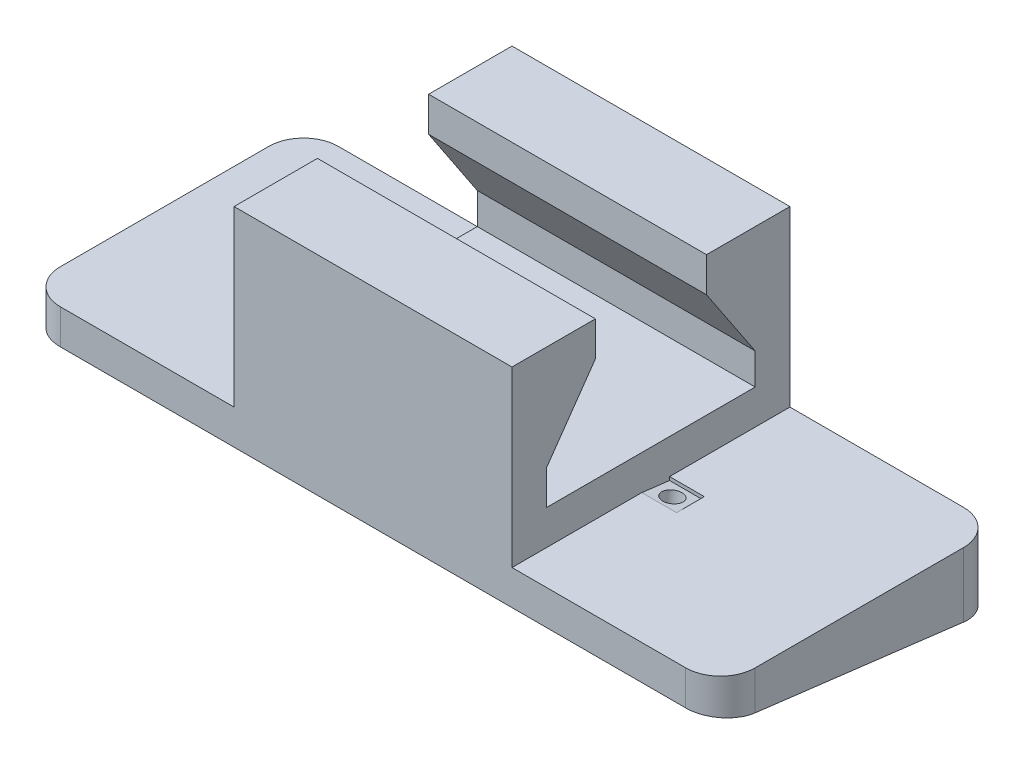
from build123d import *

# Parameters (mm, degrees)
SKETCH1_W           = 100
SKETCH1_H           = 40
BOSS_EXTRUDE1_DEPTH = 5
BOSS_EXTRUDE2_DEPTH = 5
SKETCH4_W           = 40
SKETCH4_H           = 12
BOSS_EXTRUDE3_DEPTH = 20
CUT_EXTRUDE2_DEPTH  = 70
BOSS_EXTRUDE5_DEPTH = 100
SKETCH12_R          = 1.4
CUT_EXTRUDE3_DEPTH  = 10
CUT_EXTRUDE4_DEPTH  = 30
BOSS_EXTRUDE6_DEPTH = 25
CUT_EXTRUDE5_DEPTH  = 30
BOSS_EXTRUDE7_DEPTH = 25
FILLET1_R           = 5


with BuildPart() as part:
    # Sketch1 → Boss-Extrude1 (new body)
    with BuildSketch(Plane(origin=(0, 0, 0), x_dir=(1, 0, 0), z_dir=(0, 1, 0))):
        Rectangle(SKETCH1_W, SKETCH1_H)
    extrude(amount=BOSS_EXTRUDE1_DEPTH)

    # Sketch3 → Boss-Extrude2 (add)
    with BuildSketch(Plane(origin=(0, 5, 0), x_dir=(1, 0, 0), z_dir=(0, 1, 0))):
        Polygon((0, 20), (-20, 20), (-20, -20), (20, -20), (20, 20), align=None)
    extrude(amount=BOSS_EXTRUDE2_DEPTH)

    # Sketch4 → Boss-Extrude3 (add)
    with BuildSketch(Plane(origin=(0, 10, 0), x_dir=(1, 0, 0), z_dir=(0, 1, 0))):
        with Locations((0, 14)):
            Rectangle(SKETCH4_W, SKETCH4_H)
        with Locations((0, -14)):
            Rectangle(SKETCH4_W, SKETCH4_H)
    extrude(amount=BOSS_EXTRUDE3_DEPTH)

    # Sketch10 → Cut-Extrude2 (cut)
    with BuildSketch(Plane(origin=(20, 0, 0), x_dir=(0, 0, -1), z_dir=(1, 0, 0))):
        Polygon((-8, 10), (-15, 10), (-15, 15), (-8, 25), align=None)
        Polygon((8, 10), (15, 10), (15, 14.5), (8, 25), align=None)
    extrude(amount=-CUT_EXTRUDE2_DEPTH, mode=Mode.SUBTRACT)

    # Sketch11 → Boss-Extrude5 (add)
    with BuildSketch(Plane.ZY.offset(50)):
        Polygon((20, 0), (-20, -4.911382436), (-20, 0), align=None)
    extrude(amount=-BOSS_EXTRUDE5_DEPTH)

    # Sketch12 → Cut-Extrude3 (cut)
    with BuildSketch(Plane(origin=(0, -2.419218956, 0.297042737), x_dir=(1, 0, 0), z_dir=(0, -0.992546151641323, 0.121869343405141))):
        with Locations(Location((-22.5, 0, 0), (0, 0, 270))):
            Circle(SKETCH12_R)
        with Locations(Location((22.5, 0, 0), (0, 0, 270))):
            Circle(SKETCH12_R)
    extrude(amount=-CUT_EXTRUDE3_DEPTH, mode=Mode.SUBTRACT)

    # Sketch16 → Cut-Extrude4 (cut)
    with BuildSketch(Plane.ZY.offset(50)):
        Polygon((-2.653640591, 5), (1.346359409, 5), (-2.653640591, 4.508861756), align=None)
    extrude(amount=-CUT_EXTRUDE4_DEPTH, mode=Mode.SUBTRACT)

    # Sketch17 → Boss-Extrude6 (add)
    with BuildSketch(Plane.ZY.offset(50)):
        Polygon((-2.653640591, 5), (-2.653640591, 4.508861756), (1.346359409, 5), align=None)
    extrude(amount=-BOSS_EXTRUDE6_DEPTH)

    # Sketch18 → Cut-Extrude5 (cut)
    with BuildSketch(Plane(origin=(50, 0, 0), x_dir=(0, 0, -1), z_dir=(1, 0, 0))):
        Polygon((2.679400207, 5), (-1.320599793, 5), (2.679400207, 4.508861756), align=None)
    extrude(amount=-CUT_EXTRUDE5_DEPTH, mode=Mode.SUBTRACT)

    # Sketch19 → Boss-Extrude7 (add)
    with BuildSketch(Plane(origin=(50, 0, 0), x_dir=(0, 0, -1), z_dir=(1, 0, 0))):
        Polygon((2.679400207, 4.508861756), (2.679400207, 5), (-1.320599793, 5), align=None)
    extrude(amount=-BOSS_EXTRUDE7_DEPTH)

    # Fillet1
    fillet1_edges = [part.edges().sort_by_distance(p)[0] for p in [
        (50, 0.044308782, -20),
        (50, 2.5, 20),
        (-50, 2.5, 20),
        (-50, 0.044308782, -20),
    ]]
    fillet(fillet1_edges, radius=FILLET1_R)


solid = part.part
